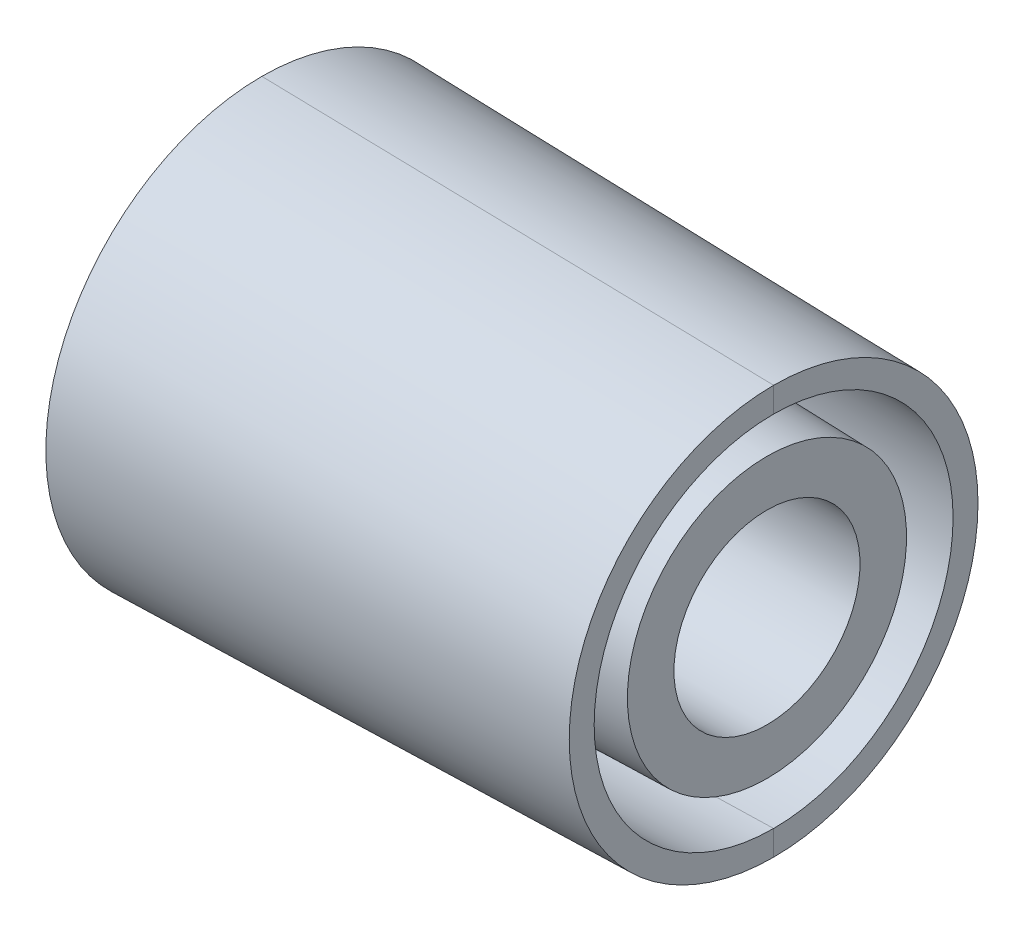
from build123d import *

# Parameters (mm, degrees)
REVOLVE1_ANGLE = 359.999999589
REVOLVE2_ANGLE = 179.99999693
REVOLVE3_ANGLE = 179.99999693


with BuildPart() as part:
    # Sketch1 → Revolve1 (revolve)
    with BuildSketch(Plane.XY):
        Polygon((1900, 280), (1900, 460), (3400, 420), (3400, 280), align=None)
    revolve(axis=Axis((0, 0, 0), (1, 0, 0)), revolution_arc=REVOLVE1_ANGLE)


with BuildPart() as body_2:
    # Sketch2 → Revolve2 (revolve)
    with BuildSketch(Plane.XY):
        Polygon((1880, 580), (1880, 650), (3420, 615), (3420, 540), align=None)
    revolve(axis=Axis((0, 0, 0), (1, 0, 0)), revolution_arc=REVOLVE2_ANGLE)


with BuildPart() as body_3:
    # Sketch3 → Revolve3 (revolve)
    with BuildSketch(Plane.XY):
        Polygon((1880, -580), (1880, -650), (3420, -615), (3420, -540), align=None)
    revolve(axis=Axis((0, 0, 0), (1, 0, 0)), revolution_arc=REVOLVE3_ANGLE)


solid = Compound([part.part, body_2.part, body_3.part])
